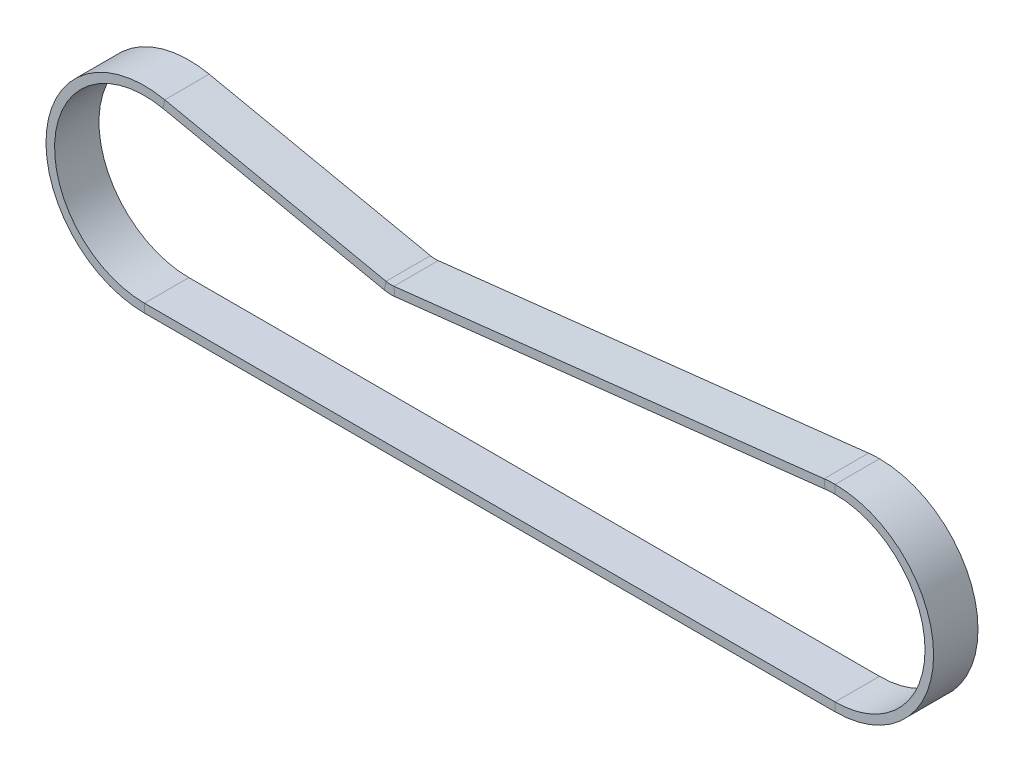
from build123d import *

# Parameters (mm, degrees)
SKETCH2_W = 9
SKETCH2_H = 1.74


with BuildPart() as part:
    # Sweep1: sweep along a path in Sketch1
    with BuildLine(Plane.XY) as sweep1_path:
        Line((-2.135359448, 18.978843514), (-89.343691975, 9.166805354))
        ThreePointArc((-89.343691975, 9.166805354), (-90.279402583, 9.136653328), (-91.208006162, 9.255644413))
        Line((-91.208006162, 9.255644413), (-136.069639142, 18.689797341))
        ThreePointArc((-136.069639142, 18.689797341), (-158.9961193, 1.975781523), (-140, -19.098593171))
        Line((-140, -19.098593171), (0, -19.098593171))
        ThreePointArc((0, -19.098593171), (19.068632256, 1.069357278), (-2.135359448, 18.978843514))
    # Sketch2 → Sweep1 (sweep)
    with BuildSketch(Plane(origin=(0, 0, 0), x_dir=(0, 0, -1), z_dir=(1, 0, 0))):
        with Locations((0, 19.098593171)):
            Rectangle(SKETCH2_W, SKETCH2_H)
    sweep(path=sweep1_path.line)


solid = part.part
